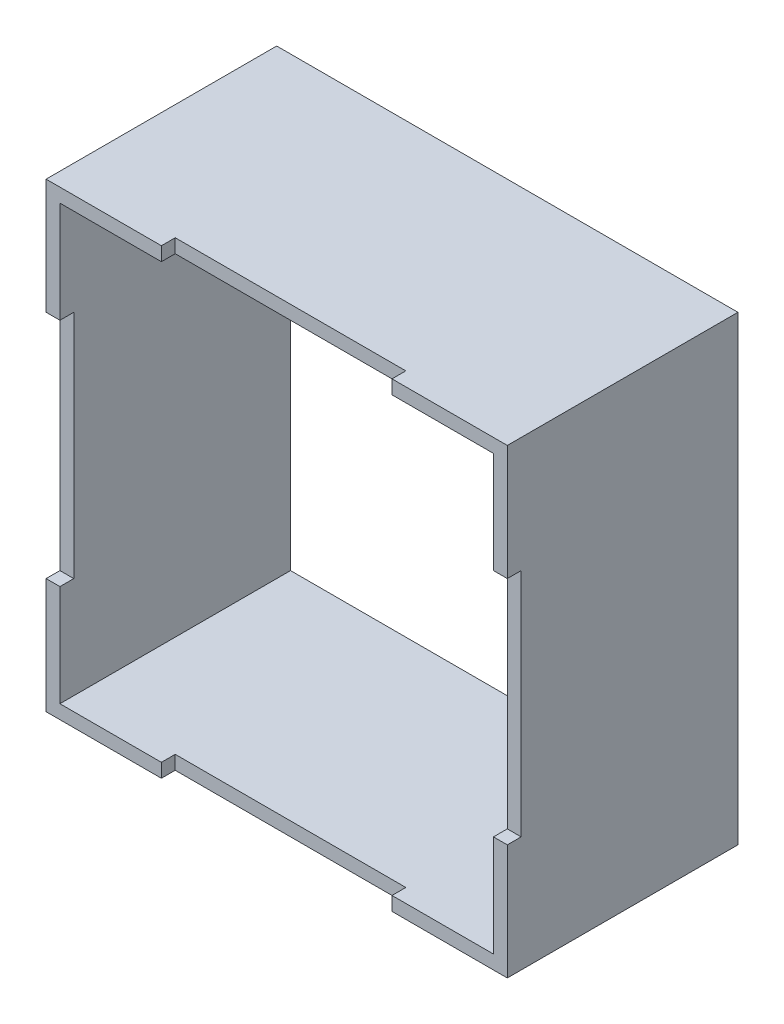
from build123d import *

# Parameters (mm, degrees)
SKETCH_1_W          = 100
SKETCH_1_H          = 100
SKETCH_1_W_2        = 94
SKETCH_1_H_2        = 94
EXTRUDE_1_DEPTH     = 50
SKETCH_2_W          = 3
SKETCH_2_H          = 50
CUT_EXTRUDE_1_DEPTH = 151
SKETCH_3_W          = 50
SKETCH_3_H          = 3
CUT_EXTRUDE_2_DEPTH = 151


with BuildPart() as part:
    # 草图1 → 凸台-拉伸1 (new body)
    with BuildSketch(Plane.XY):
        with Locations((50, -50)):
            Rectangle(SKETCH_1_W, SKETCH_1_H)
        with Locations((50, -50)):
            Rectangle(SKETCH_1_W_2, SKETCH_1_H_2, mode=Mode.SUBTRACT)
    extrude(amount=EXTRUDE_1_DEPTH)

    # 草图2 → 切除-拉伸1 (cut, through all)
    with BuildSketch(Plane.ZY):
        with Locations((48.5, -50)):
            Rectangle(SKETCH_2_W, SKETCH_2_H)
    extrude(amount=-CUT_EXTRUDE_1_DEPTH, mode=Mode.SUBTRACT)

    # 草图3 → 切除-拉伸2 (cut, through all)
    with BuildSketch(Plane.XZ.offset(100)):
        with Locations((50, 48.5)):
            Rectangle(SKETCH_3_W, SKETCH_3_H)
    extrude(amount=-CUT_EXTRUDE_2_DEPTH, mode=Mode.SUBTRACT)


solid = part.part
